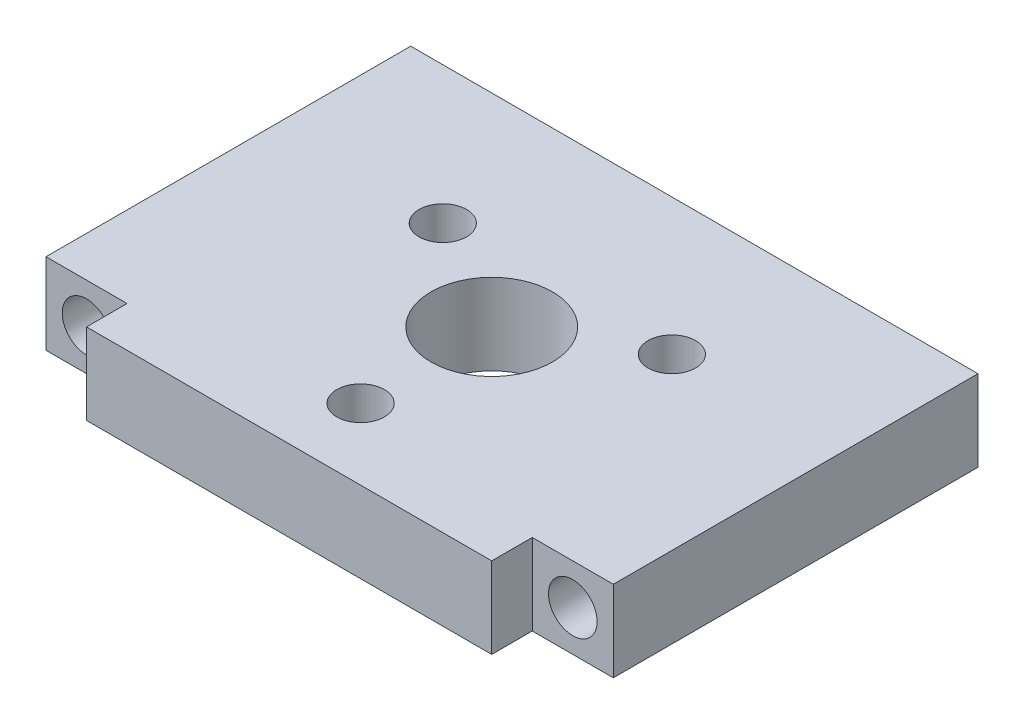
from build123d import *

# Parameters (mm, degrees)
ESQUISSE1_W             = 28
ESQUISSE1_H             = 4
BOSS_EXTRU_1_DEPTH      = 20
ESQUISSE2_R             = 1.2
ENL_V_MAT_EXTRU_1_DEPTH = 35.641016151
ESQUISSE3_R             = 3
ESQUISSE3_R_2           = 1.173644897
ENL_V_MAT_EXTRU_3_DEPTH = 35.641016151
ESQUISSE4_W             = 4
ESQUISSE4_H             = 4
ENL_V_MAT_EXTRU_4_DEPTH = 2


with BuildPart() as part:
    # Esquisse1 → Boss.-Extru.1 (new body)
    with BuildSketch(Plane.XY):
        with Locations((14, 2)):
            Rectangle(ESQUISSE1_W, ESQUISSE1_H)
    extrude(amount=BOSS_EXTRU_1_DEPTH)

    # Esquisse2 → Enlèv. mat.-Extru.1 (cut, through all)
    with BuildSketch(Plane.XY.offset(20)):
        with Locations((2, 2)):
            Circle(ESQUISSE2_R)
        with Locations((26, 2)):
            Circle(ESQUISSE2_R)
    extrude(amount=-ENL_V_MAT_EXTRU_1_DEPTH, mode=Mode.SUBTRACT)

    # Esquisse3 → Enlèv. mat.-Extru.3 (cut, through all)
    with BuildSketch(Plane(origin=(0, 4, 0), x_dir=(1, 0, 0), z_dir=(0, 1, 0))):
        with Locations(Location((14, -10, 0), (0, 0, 270))):
            Circle(ESQUISSE3_R)
        with Locations(Location((8.35754662, -6.773125373, 0), (0, 0, 270))):
            Circle(ESQUISSE3_R_2)
        with Locations(Location((19.615782092, -6.726929347, 0), (0, 0, 270))):
            Circle(ESQUISSE3_R_2)
        with Locations(Location((14.026671288, -16.49994528, 0), (0, 0, 270))):
            Circle(ESQUISSE3_R_2)
    extrude(amount=-ENL_V_MAT_EXTRU_3_DEPTH, mode=Mode.SUBTRACT)

    # Esquisse4 → Enlèv. mat.-Extru.4 (cut)
    with BuildSketch(Plane.XY.offset(20)):
        with Locations((2, 2)):
            Rectangle(ESQUISSE4_W, ESQUISSE4_H)
        with Locations((26, 2)):
            Rectangle(ESQUISSE4_W, ESQUISSE4_H)
    extrude(amount=-ENL_V_MAT_EXTRU_4_DEPTH, mode=Mode.SUBTRACT)


solid = part.part
